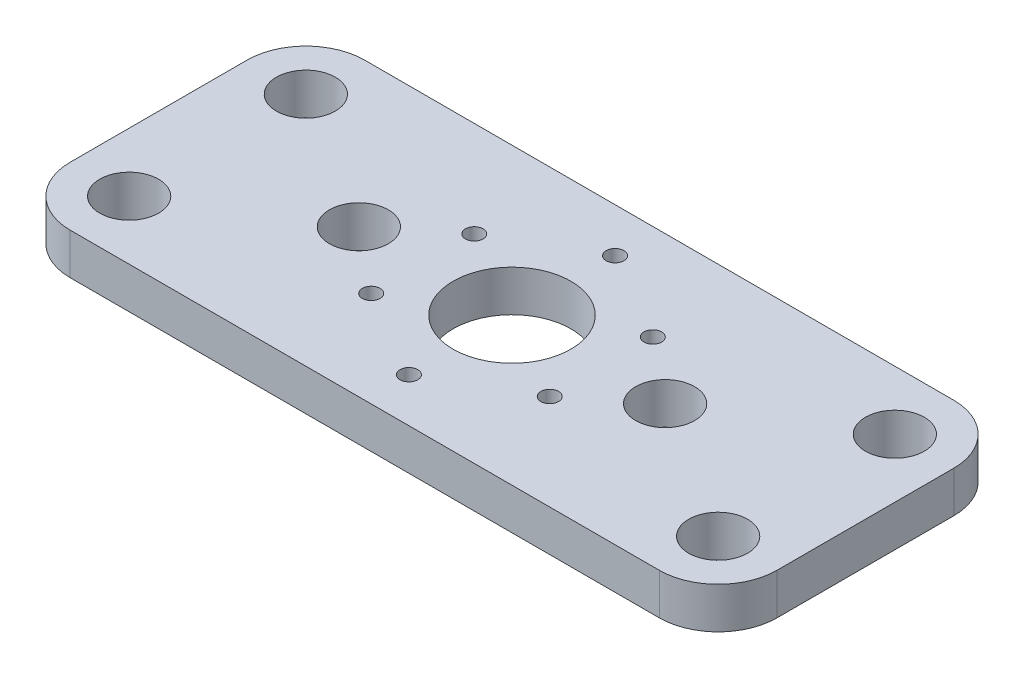
from build123d import *

# Parameters (mm, degrees)
SKETCH1_R           = 10
SKETCH1_R_2         = 1.5
SKETCH1_R_3         = 5
BOSS_EXTRUDE1_DEPTH = 7


with BuildPart() as part:
    # Sketch1 → Boss-Extrude1 (new body)
    with BuildSketch(Plane(origin=(0, 0, 0), x_dir=(1, 0, 0), z_dir=(0, 1, 0))):
        with BuildLine():
            Line((-50, -25), (50, -25))
            ThreePointArc((50, -25), (57.071067812, -22.071067812), (60, -15))
            Line((60, -15), (60, 15))
            ThreePointArc((60, 15), (57.071067812, 22.071067812), (50, 25))
            Line((50, 25), (-50, 25))
            ThreePointArc((-50, 25), (-57.071067812, 22.071067812), (-60, 15))
            Line((-60, 15), (-60, -15))
            ThreePointArc((-60, -15), (-57.071067812, -22.071067812), (-50, -25))
        make_face()
        with Locations(Location((0, 0, 0), (0, 0, 270))):
            Circle(SKETCH1_R, mode=Mode.SUBTRACT)
        with Locations(Location((0, 17.5, 0), (0, 0, 270))):
            Circle(SKETCH1_R_2, mode=Mode.SUBTRACT)
        with Locations(Location((-26, 0, 0), (0, 0, 270))):
            Circle(SKETCH1_R_3, mode=Mode.SUBTRACT)
        with Locations(Location((26, 0, 0), (0, 0, 270))):
            Circle(SKETCH1_R_3, mode=Mode.SUBTRACT)
        with Locations(Location((-50, 15, 0), (0, 0, 270))):
            Circle(SKETCH1_R_3, mode=Mode.SUBTRACT)
        with Locations(Location((-50, -15, 0), (0, 0, 270))):
            Circle(SKETCH1_R_3, mode=Mode.SUBTRACT)
        with Locations(Location((50, -15, 0), (0, 0, 270))):
            Circle(SKETCH1_R_3, mode=Mode.SUBTRACT)
        with Locations(Location((50, 15, 0), (0, 0, 270))):
            Circle(SKETCH1_R_3, mode=Mode.SUBTRACT)
        with Locations(Location((15.155444566, 8.75, 0), (0, 0, 270))):
            Circle(SKETCH1_R_2, mode=Mode.SUBTRACT)
        with Locations(Location((15.155444566, -8.75, 0), (0, 0, 270))):
            Circle(SKETCH1_R_2, mode=Mode.SUBTRACT)
        with Locations(Location((0, -17.5, 0), (0, 0, 270))):
            Circle(SKETCH1_R_2, mode=Mode.SUBTRACT)
        with Locations(Location((-15.155444566, -8.75, 0), (0, 0, 270))):
            Circle(SKETCH1_R_2, mode=Mode.SUBTRACT)
        with Locations(Location((-15.155444566, 8.75, 0), (0, 0, 270))):
            Circle(SKETCH1_R_2, mode=Mode.SUBTRACT)
    extrude(amount=BOSS_EXTRUDE1_DEPTH)


solid = part.part
